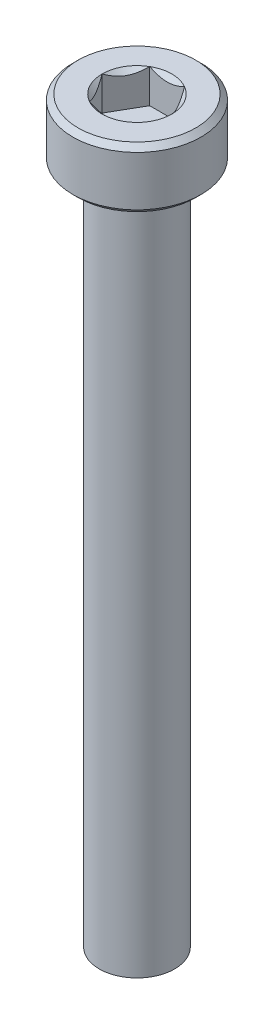
from build123d import *

# Parameters (mm, degrees)
SKETCH1_R           = 4.25
BOSS_EXTRUDE1_DEPTH = 4
CUT_EXTRUDE1_DEPTH  = 2.25
CHAMFER1_SIZE       = 0.35
SKETCH_1_R          = 2.5
EXTRUDE_1_DEPTH     = 45


with BuildPart() as part:
    # Sketch1 → Boss-Extrude1 (new body)
    with BuildSketch(Plane(origin=(0, 0, 0), x_dir=(1, 0, 0), z_dir=(0, 1, 0))):
        with Locations(Location((0, 0, 0), (0, 0, 270))):
            Circle(SKETCH1_R)
    extrude(amount=BOSS_EXTRUDE1_DEPTH)

    # Sketch2 → Cut-Extrude1 (cut)
    with BuildSketch(Plane(origin=(0, 4, 0), x_dir=(1, 0, 0), z_dir=(0, 1, 0))):
        Polygon((1.154700538, 2), (-1.154700538, 2), (-2.309401077, 0), (-1.154700538, -2), (1.154700538, -2), (2.309401077, 0), align=None)
    extrude(amount=-CUT_EXTRUDE1_DEPTH, mode=Mode.SUBTRACT)

    # Cut-Extrude2 cone 1 section (through the dimple's axis) → Cut-Extrude2 (revolve, cut)
    with BuildSketch(Plane(origin=(0, 4, 0), x_dir=(0, 0, 1), z_dir=(1, 0, 0))):
        Polygon((0, 0), (2.309401077, 0), (0, 2.309401077), align=None)
    revolve(axis=Axis((0, 4, 0), (0, -1, 0)), mode=Mode.SUBTRACT)

    # Chamfer1
    chamfer1_edges = [part.edges().sort_by_distance(p)[0] for p in [
        (0, 0, -4.25),
        (0, 4, -4.25),
    ]]
    chamfer(chamfer1_edges, length=CHAMFER1_SIZE)

    # 草图1 → 凸台-拉伸1 (add)
    with BuildSketch(Plane(origin=(0, 0, 0), x_dir=(-1, 0, 0), z_dir=(0, -1, 0))):
        with Locations(Location((0, 0, 0), (0, 0, 270))):
            Circle(SKETCH_1_R)
    extrude(amount=EXTRUDE_1_DEPTH)


solid = part.part
